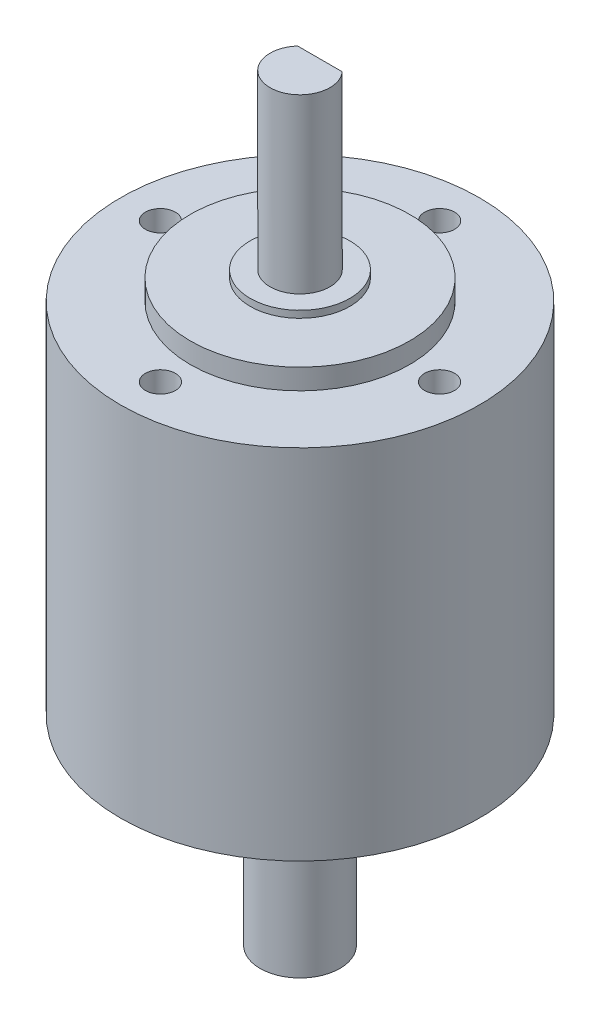
from build123d import *

# Parameters (mm, degrees)
SKETCH1_R           = 18
BOSS_EXTRUDE1_DEPTH = 17.9451
BOSS_EXTRUDE2_START = -17.9451
SKETCH2_R           = 11
BOSS_EXTRUDE2_DEPTH = 20.0025
SKETCH3_R           = 3
BOSS_EXTRUDE4_DEPTH = 18
CUT_EXTRUDE1_START  = -15
CUT_EXTRUDE1_DEPTH  = 15
SKETCH5_R           = 1.5
CUT_EXTRUDE2_DEPTH  = 4
SKETCH6_R           = 4
BOSS_EXTRUDE5_DEPTH = 18
CUT_EXTRUDE3_START  = -15
CUT_EXTRUDE3_DEPTH  = 15
SKETCH9_R           = 5
BOSS_EXTRUDE6_DEPTH = 20.701


with BuildPart() as part:
    # Sketch1 → Boss-Extrude1 (new, symmetric)
    with BuildSketch(Plane(origin=(0, 0, 0), x_dir=(1, 0, 0), z_dir=(0, 1, 0))):
        with Locations(Location((0, 0, 0), (0, 0, 270))):
            Circle(SKETCH1_R)
    extrude(amount=BOSS_EXTRUDE1_DEPTH, both=True)

    # Sketch2 → Boss-Extrude2 (add, symmetric)
    with BuildSketch(Plane(origin=(0, 17.9451, 0), x_dir=(1, 0, 0), z_dir=(0, 1, 0)).offset(BOSS_EXTRUDE2_START)):
        with Locations(Location((0, 0, 0), (0, 0, 270))):
            Circle(SKETCH2_R)
    extrude(amount=BOSS_EXTRUDE2_DEPTH, both=True)

    # Sketch3 → Boss-Extrude4 (add)
    with BuildSketch(Plane(origin=(0, 20.0025, 0), x_dir=(1, 0, 0), z_dir=(0, 1, 0))):
        with Locations(Location((0, 0, 0), (0, 0, 270))):
            Circle(SKETCH3_R)
    extrude(amount=BOSS_EXTRUDE4_DEPTH)

    # Sketch4 → Cut-Extrude1 (cut)
    with BuildSketch(Plane(origin=(0, 38.0025, 0), x_dir=(1, 0, 0), z_dir=(0, 1, 0)).offset(CUT_EXTRUDE1_START)):
        with BuildLine():
            Line((-2.236067977, 2), (2.236067977, 2))
            ThreePointArc((2.236067977, 2), (0, 3), (-2.236067977, 2))
        make_face()
    cut_extrude1 = extrude(amount=CUT_EXTRUDE1_DEPTH, mode=Mode.SUBTRACT)

    # Sketch5 → Cut-Extrude2 (cut)
    with BuildSketch(Plane(origin=(0, 17.9451, 0), x_dir=(1, 0, 0), z_dir=(0, 1, 0))):
        with Locations(Location((0, 14, 0), (0, 0, 270))):
            Circle(SKETCH5_R)
        with Locations(Location((-14, 0, 0), (0, 0, 270))):
            Circle(SKETCH5_R)
        with Locations(Location((0, -14, 0), (0, 0, 270))):
            Circle(SKETCH5_R)
        with Locations(Location((14, 0, 0), (0, 0, 270))):
            Circle(SKETCH5_R)
    cut_extrude2 = extrude(amount=-CUT_EXTRUDE2_DEPTH, mode=Mode.SUBTRACT)

    # Mirror1: Cut-Extrude1, Cut-Extrude2 across plane
    add(cut_extrude1.mirror(Plane.ZX), mode=Mode.SUBTRACT)
    add(cut_extrude2.mirror(Plane.ZX), mode=Mode.SUBTRACT)

    # Sketch6 → Boss-Extrude5 (add)
    with BuildSketch(Plane.XZ.offset(20.0025)):
        with Locations(Location((0, 0, 0), (0, 0, 270))):
            Circle(SKETCH6_R)
    extrude(amount=BOSS_EXTRUDE5_DEPTH)

    # Sketch7 → Cut-Extrude3 (cut)
    with BuildSketch(Plane.XZ.offset(38.0025).offset(CUT_EXTRUDE3_START)):
        with BuildLine():
            Line((-2.645751311, -3), (2.645751311, -3))
            ThreePointArc((2.645751311, -3), (0, -4), (-2.645751311, -3))
        make_face()
    extrude(amount=CUT_EXTRUDE3_DEPTH, mode=Mode.SUBTRACT)

    # Sketch9 → Boss-Extrude6 (add, symmetric)
    with BuildSketch(Plane(origin=(0, 0, 0), x_dir=(1, 0, 0), z_dir=(0, 1, 0))):
        with Locations(Location((0, 0, 0), (0, 0, 270))):
            Circle(SKETCH9_R)
    extrude(amount=BOSS_EXTRUDE6_DEPTH, both=True)


solid = part.part
